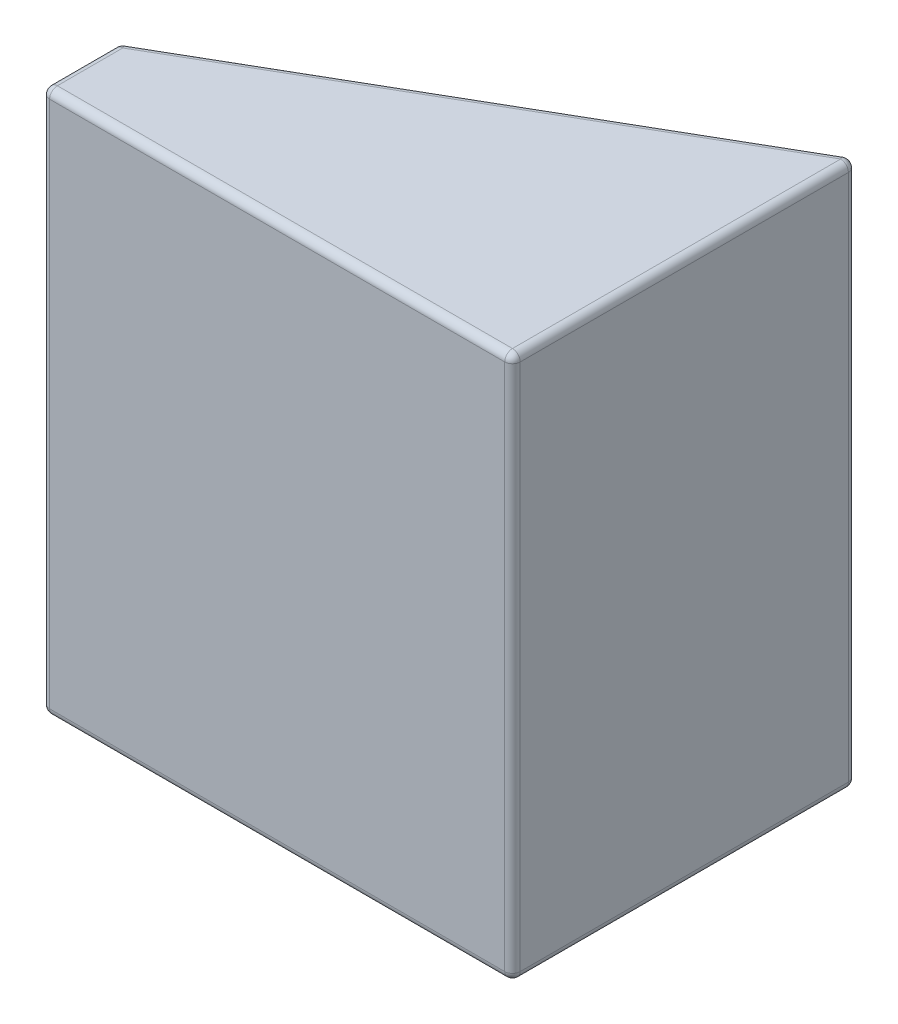
from build123d import *

# Parameters (mm, degrees)
BOSS_EXTRUDE1_DEPTH = 177.8
SKETCH4_W           = 153.979316793
SKETCH4_H           = 25.4
BOSS_EXTRUDE4_DEPTH = 177.8
SKETCH3_R           = 73.2155
CUT_EXTRUDE2_DEPTH  = 25.4
FILLET1_R           = 2.54


with BuildPart() as part:
    # Sketch2 → Boss-Extrude1 (new body)
    with BuildSketch(Plane(origin=(0, 0, 0), x_dir=(1, 0, 0), z_dir=(0, 1, 0))):
        Polygon((0, 0), (153.979316793, 0), (153.979316793, 88.9), align=None)
    extrude(amount=BOSS_EXTRUDE1_DEPTH)

    # Sketch4 → Boss-Extrude4 (add)
    with BuildSketch(Plane(origin=(0, 0, 0), x_dir=(-1, 0, 0), z_dir=(0, -1, 0))):
        with Locations((-76.989658397, -12.7)):
            Rectangle(SKETCH4_W, SKETCH4_H)
    extrude(amount=-BOSS_EXTRUDE4_DEPTH)

    # Sketch3 → Cut-Extrude2 (cut)
    with BuildSketch(Plane(origin=(0, 0, 0), x_dir=(-0.8660254037844386, 0, 0.5), z_dir=(-0.5000000000000001, 0, -0.8660254037844387))):
        with Locations((-88.9, 88.9)):
            Circle(SKETCH3_R)
    extrude(amount=-CUT_EXTRUDE2_DEPTH, mode=Mode.SUBTRACT)

    # Fillet1
    fillet1_edges = [part.edges().sort_by_distance(p)[0] for p in [
        (153.979316793, 88.9, 25.4),
        (0, 88.9, 25.4),
        (76.989658396, 0, 25.4),
        (0, 0, 12.7),
        (76.989658396, 177.8, -44.45),
        (0, 177.8, 12.7),
        (76.989658396, 177.8, 25.4),
        (140.396141347, 88.9, -81.05775),
        (76.989658396, 0, -44.45),
        (153.979316793, 0, -31.75),
        (0, 88.9, 0),
        (153.979316793, 88.9, -88.9),
        (153.979316793, 177.8, -31.75),
    ]]
    fillet(fillet1_edges, radius=FILLET1_R)


solid = part.part
